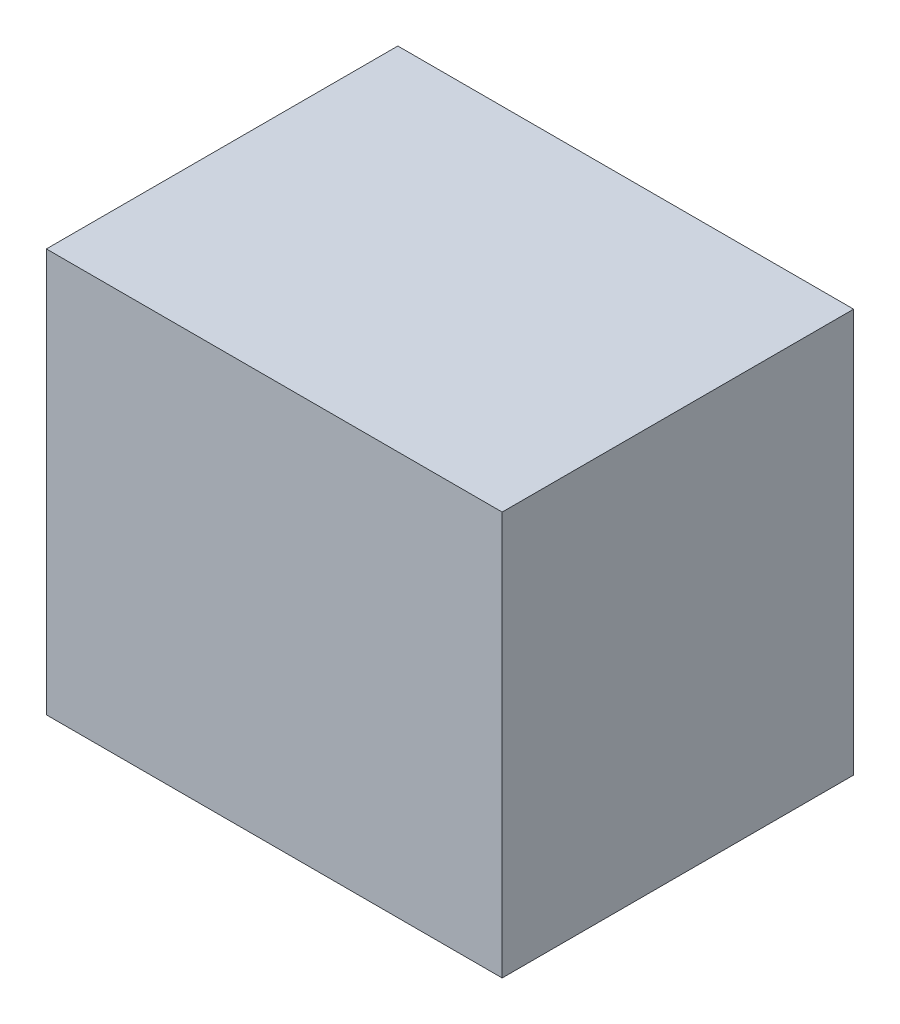
from build123d import *

# Parameters (mm, degrees)
BOSS_EXTRUDE1_DEPTH      = 4.765
BOSS_EXTRUDE1_DEPTH_BACK = 4.765
CUT_EXTRUDE1_DEPTH       = 134.257142857
CUT_EXTRUDE2_DEPTH       = 176.166857025
BOSS_EXTRUDE2_DEPTH      = 25.4
BOSS_EXTRUDE3_REACH      = 168.247
BOSS_EXTRUDE4_REACH      = 162.602
CUT_EXTRUDE4_DEPTH       = 176.073535498
CUT_EXTRUDE4_DEPTH_BACK  = 176.073535498
SKETCH8_W                = 29.497845824
SKETCH8_H                = 11.821808138
BOSS_EXTRUDE5_REACH      = 162.602
SKETCH10_W               = 677.744852518
SKETCH10_H               = 522.587521888
BOSS_EXTRUDE6_DEPTH      = 600


with BuildPart() as part:
    # Sketch1 → Boss-Extrude1 (new, two sides: drawn at the far end of the back side and taken through both)
    with BuildSketch(Plane.XY.offset(-BOSS_EXTRUDE1_DEPTH_BACK)):
        Polygon((0, 0), (150.63, 0), (87.13, 88.9), (12.3, 88.9), align=None)
    extrude(amount=BOSS_EXTRUDE1_DEPTH + BOSS_EXTRUDE1_DEPTH_BACK)

    # Sketch2 → Cut-Extrude1 (cut, along a direction that is not the sketch's normal)
    with BuildSketch(Plane.XZ):
        Polygon((150.63, 0), (133.34, 4.765), (171.670273927, 17.698707495), (171.005533739, -7.644512157), (148.071997267, -23.348999089), (133.34, -4.765), align=None)
    extrude(amount=-CUT_EXTRUDE1_DEPTH, dir=(0.5812381937190965, -0.8137334712067349, 0), mode=Mode.SUBTRACT)

    # Sketch3 → Cut-Extrude2 (cut, through all)
    with BuildSketch(Plane.XY.offset(4.765)):
        Polygon((29.799719665, 76.3835184), (10.929478609, 78.99436165), (7.448354274, 53.834040242), (26.31859533, 51.223196991), align=None)
    extrude(amount=-CUT_EXTRUDE2_DEPTH, mode=Mode.SUBTRACT)

    # Sketch4 → Boss-Extrude2 (add)
    with BuildSketch(Plane(origin=(10.929478609, 78.99436165, 0), x_dir=(0.9905638349724135, -0.1370521391469141, 0), z_dir=(-0.1370521391469141, -0.9905638349724135, 0))):
        Polygon((-1.906104256, -1.760525647), (0, -2.096623256), (0, 4.765), (14.191997191, 4.765), (14.245516561, 5.068523432), (-0.251237123, 7.624692239), align=None)
        with BuildLine():
            Line((0, -2.096623256), (12.590649428, -4.316694454))
            Line((12.590649428, -4.316694454), (12.940515204, -2.332507041))
            ThreePointArc((12.940515204, -2.332507041), (12.103172864, 0.607768622), (13.895650785, 3.084336019))
            Line((13.895650785, 3.084336019), (14.191997191, 4.765))
            Line((14.191997191, 4.765), (0, 4.765))
            Line((0, 4.765), (0, -2.096623256))
        make_face()
        with BuildLine():
            ThreePointArc((13.895650785, 3.084336019), (12.103172864, 0.607768622), (12.940515204, -2.332507041))
            Line((12.940515204, -2.332507041), (13.895650785, 3.084336019))
        make_face()
        with BuildLine():
            ThreePointArc((12.940515204, -2.332507041), (14.942231378, -3.446827136), (17.204349215, -3.084336019))
            Line((17.204349215, -3.084336019), (18.159484796, 2.332507041))
            ThreePointArc((18.159484796, 2.332507041), (16.157768622, 3.446827136), (13.895650785, 3.084336019))
            Line((13.895650785, 3.084336019), (12.940515204, -2.332507041))
        make_face()
        with BuildLine():
            ThreePointArc((13.895650785, 3.084336019), (16.157768622, 3.446827136), (18.159484796, 2.332507041))
            Line((18.159484796, 2.332507041), (18.509350572, 4.316694454))
            Line((18.509350572, 4.316694454), (15.966883482, 4.765))
            Line((15.966883482, 4.765), (14.191997191, 4.765))
            Line((14.191997191, 4.765), (13.895650785, 3.084336019))
        make_face()
        Polygon((14.245516561, 5.068523432), (14.191997191, 4.765), (15.966883482, 4.765), align=None)
        with BuildLine():
            Line((12.590649428, -4.316694454), (15.133116518, -4.765))
            Line((15.133116518, -4.765), (16.908002809, -4.765))
            Line((16.908002809, -4.765), (17.204349215, -3.084336019))
            ThreePointArc((17.204349215, -3.084336019), (14.942231378, -3.446827136), (12.940515204, -2.332507041))
            Line((12.940515204, -2.332507041), (12.590649428, -4.316694454))
        make_face()
        Polygon((15.133116518, -4.765), (16.854483439, -5.068523432), (16.908002809, -4.765), align=None)
    extrude(amount=BOSS_EXTRUDE2_DEPTH)

    # Boss-Extrude3: up to this plane
    boss_extrude3_end = Plane(origin=(18.870241056, -2.610843251, -4.765), z_dir=(-0.9905638349724135, 0.13705213914691478, 0))
    # Sketch5 → Boss-Extrude3 (add, up to the surface)
    with BuildSketch(Plane(origin=(17.050602168, -2.35908219, -3.035121103), x_dir=(-0.1720096048057269, 0.02379885420821639, -0.9848077530122078), z_dir=(0.9755149445343381, -0.134970009198789, -0.17364817766693175)), mode=Mode.PRIVATE) as boss_extrude3_sk1:
        Polygon((1.756565067, 54.346866241), (2.064770837, 54.346866241), (2.064770837, 79.746866241), (1.756565067, 79.746866241), (-7.465229163, 79.746866241), (-7.465229163, 54.346866241), align=None)
    boss_extrude3_tool1 = split(extrude(boss_extrude3_sk1.sketch, amount=BOSS_EXTRUDE3_REACH, dir=(1, 0, 0), mode=Mode.PRIVATE), bisect_by=boss_extrude3_end, keep=Keep.BOTH, mode=Mode.PRIVATE)
    add(boss_extrude3_tool1.solids().sort_by_distance((26.703984, 63.990856, -0.375914))[0])

    # Boss-Extrude4: up to this face of the body (flat: up to its plane)
    boss_extrude4_end = Plane(part.part.faces().sort_by_distance((18.23182988, 65.163044194, 5.970693347))[0])
    # Sketch6 → Boss-Extrude4 (add, up to the picked face)
    with BuildSketch(Plane(origin=(18.870241056, -2.610843251, 0), x_dir=(0, 0, 1), z_dir=(-0.9905638349724135, 0.1370521391469148, 0)), mode=Mode.PRIVATE) as boss_extrude4_sk1:
        Polygon((4.765, 79.746866241), (4.316694454, 79.746866241), (4.316694454, 54.421669255), (-4.765, 54.643228057), (-4.765, 54.346866241), (4.765, 54.346866241), align=None)
    boss_extrude4_tool1 = split(extrude(boss_extrude4_sk1.sketch, amount=BOSS_EXTRUDE4_REACH, mode=Mode.PRIVATE), bisect_by=boss_extrude4_end, keep=Keep.BOTH, mode=Mode.PRIVATE)
    add(boss_extrude4_tool1.solids().sort_by(Axis((29.762539, 76.114789, 4.540847), (-0.9905638349724135, 0.1370521391469148, 0)))[0])

    # Sketch8 → Cut-Extrude4 (cut, two sides: drawn at the far end of the back side and taken through both)
    with BuildSketch(Plane(origin=(0, 88.9, 0), x_dir=(1, 0, 0), z_dir=(0, 1, 0)).offset(-CUT_EXTRUDE4_DEPTH_BACK)):
        with Locations((33.561006967, 10.675904069)):
            Rectangle(SKETCH8_W, SKETCH8_H)
    extrude(amount=CUT_EXTRUDE4_DEPTH + CUT_EXTRUDE4_DEPTH_BACK, mode=Mode.SUBTRACT)

    # Sketch9 → Boss-Extrude5 (add, up to next)
    with BuildSketch(Plane(origin=(18.870241056, -2.610843251, 0), x_dir=(0, 0, 1), z_dir=(-0.9905638349724135, 0.1370521391469148, 0)), mode=Mode.PRIVATE) as boss_extrude5_sk1:
        Polygon((4.221363373, 54.346866241), (4.221363373, 54.423994971), (-4.765, 54.643228057), (-4.765, 54.346866241), align=None)
    boss_extrude5_tool1 = extrude(boss_extrude5_sk1.sketch, amount=BOSS_EXTRUDE5_REACH, mode=Mode.PRIVATE) - part.part
    add(boss_extrude5_tool1.solids().sort_by_distance((26.332862, 51.326311, -1.150961))[0])


with BuildPart() as body_2:
    # Sketch10 → Boss-Extrude6 (new body)
    # profile 1 of 2: a face of its own
    with BuildSketch(Plane.XZ):
        Rectangle(SKETCH10_W, SKETCH10_H)
        Polygon((150.63, 0), (133.34, 4.765), (0, 4.765), (0, -4.765), (133.34, -4.765), align=None, mode=Mode.SUBTRACT)
    # profile 2 of 2: a face of its own
    with BuildSketch(Plane.XZ):
        Polygon((133.34, -4.765), (150.63, 0), (133.34, 4.765), (0, 4.765), (0, -4.765), align=None)
    extrude(amount=-BOSS_EXTRUDE6_DEPTH)


solid = Compound([part.part, body_2.part])
